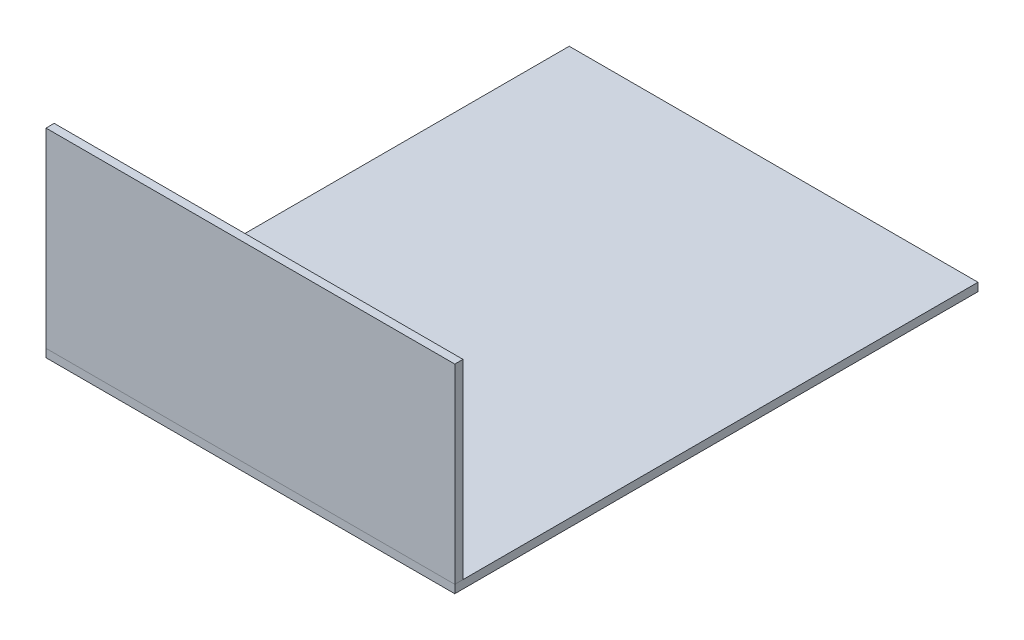
from build123d import *

# Parameters (mm, degrees)
SKETCH1_W           = 300
SKETCH1_H           = 384
BOSS_EXTRUDE1_DEPTH = 6
SKETCH2_W           = 300
SKETCH2_H           = 6
BOSS_EXTRUDE2_DEPTH = 140


with BuildPart() as part:
    # Sketch1 → Boss-Extrude1 (new body)
    with BuildSketch(Plane(origin=(0, 0, 0), x_dir=(1, 0, 0), z_dir=(0, 1, 0))):
        Rectangle(SKETCH1_W, SKETCH1_H)
    extrude(amount=BOSS_EXTRUDE1_DEPTH)


with BuildPart() as body_2:
    # Sketch2 → Boss-Extrude2 (new body)
    with BuildSketch(Plane(origin=(0, 6, 0), x_dir=(1, 0, 0), z_dir=(0, 1, 0))):
        with Locations((0, -189)):
            Rectangle(SKETCH2_W, SKETCH2_H)
    extrude(amount=BOSS_EXTRUDE2_DEPTH)


solid = Compound([part.part, body_2.part])
